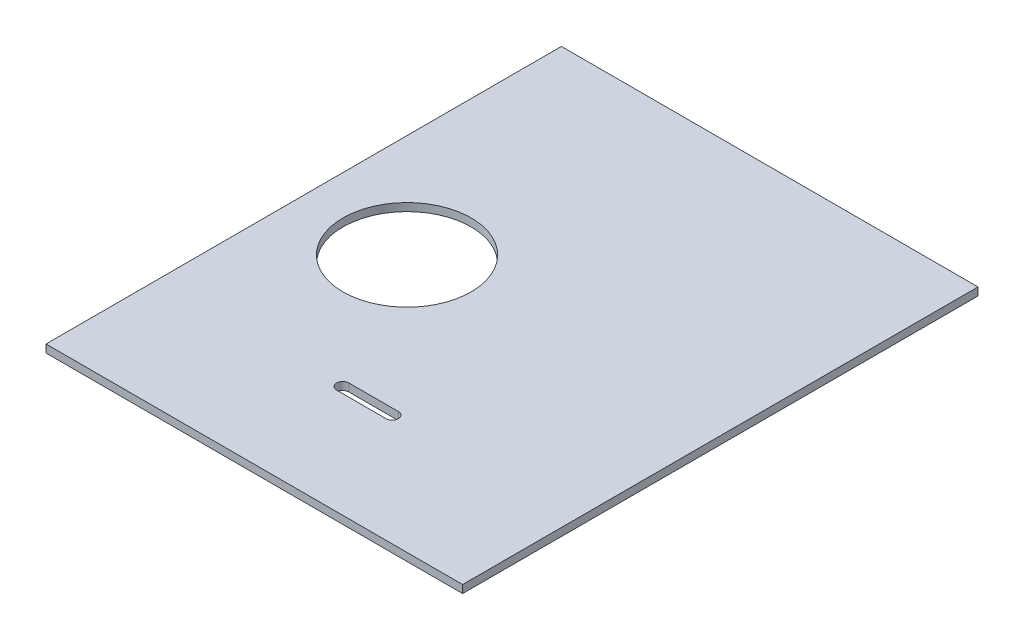
from build123d import *

# Parameters (mm, degrees)
SKETCH1_W           = 168.65
SKETCH1_H           = 208.65
BOSS_EXTRUDE1_DEPTH = 3.18
CUT_EXTRUDE1_REACH  = 136.181
CUT_EXTRUDE24_REACH = 136.181
SKETCH45_R          = 25.951103398


with BuildPart() as part:
    # Sketch1 → Boss-Extrude1 (new body)
    with BuildSketch(Plane(origin=(0, 0, 0), x_dir=(1, 0, 0), z_dir=(0, 1, 0))):
        Rectangle(SKETCH1_W, SKETCH1_H)
    extrude(amount=BOSS_EXTRUDE1_DEPTH)

    # Sketch2 → Cut-Extrude1 (cut, up to next)
    with BuildSketch(Plane(origin=(0, 3.18, 0), x_dir=(1, 0, 0), z_dir=(0, 1, 0)), mode=Mode.PRIVATE) as cut_extrude1_sk1:
        with BuildLine():
            Line((10.675, -56.675), (-9.325, -56.675))
            ThreePointArc((-9.325, -56.675), (-11.825, -59.175), (-9.325, -61.675))
            Line((-9.325, -61.675), (10.675, -61.675))
            ThreePointArc((10.675, -61.675), (13.175, -59.175), (10.675, -56.675))
        make_face()
    cut_extrude1_tool1 = extrude(cut_extrude1_sk1.sketch, amount=-CUT_EXTRUDE1_REACH, mode=Mode.PRIVATE) & part.part
    add(cut_extrude1_tool1.solids().sort_by_distance((0.675, 3.18, 59.175))[0], mode=Mode.SUBTRACT)

    # Sketch45 → Cut-Extrude24 (cut, up to next)
    with BuildSketch(Plane(origin=(0, 3.18, 0), x_dir=(1, 0, 0), z_dir=(0, 1, 0)), mode=Mode.PRIVATE) as cut_extrude24_sk1:
        with Locations(Location((-42.4825, 0, 0), (0, 0, 270))):
            Circle(SKETCH45_R)
    cut_extrude24_tool1 = extrude(cut_extrude24_sk1.sketch, amount=-CUT_EXTRUDE24_REACH, mode=Mode.PRIVATE) & part.part
    add(cut_extrude24_tool1.solids().sort_by_distance((-42.4825, 3.18, 0))[0], mode=Mode.SUBTRACT)


solid = part.part
